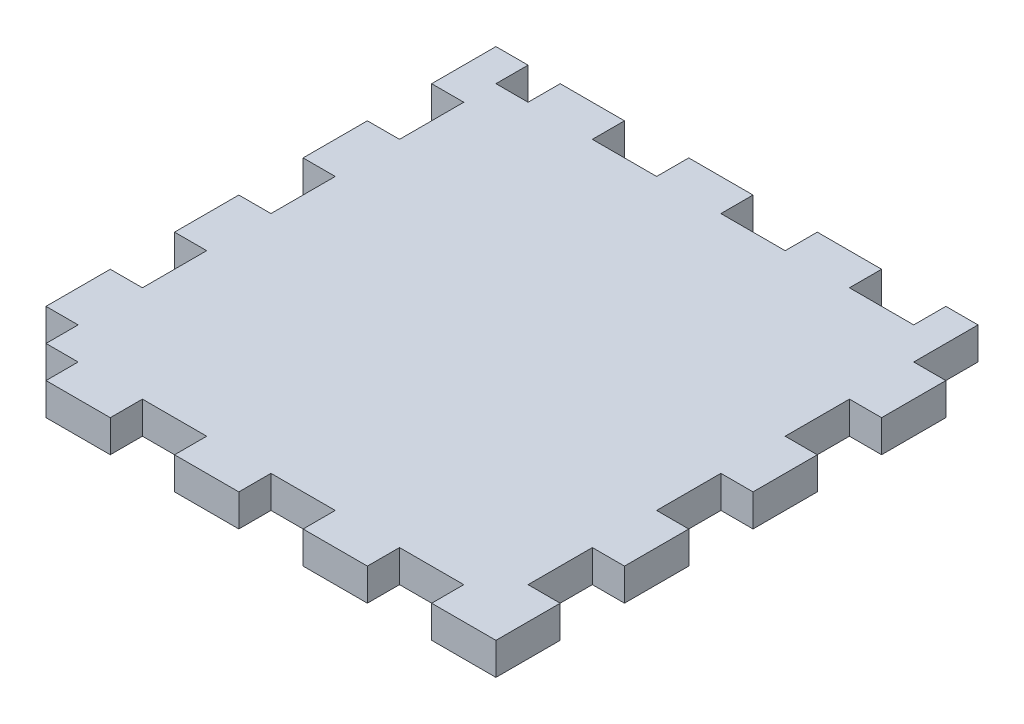
from build123d import *

# Parameters (mm, degrees)
SKETCH1_W           = 101.6
SKETCH1_H           = 101.6
BOSS_EXTRUDE1_DEPTH = 6.35
SKETCH2_W           = 6.35
SKETCH2_H           = 12.7
SKETCH2_H_2         = 6.35
CUT_EXTRUDE1_DEPTH  = 144.824345992
SKETCH2_3_W         = 6.35
SKETCH2_3_H         = 6.35
SKETCH2_3_W_2       = 12.7
CUT_EXTRUDE2_DEPTH  = 6.35


with BuildPart() as part:
    # Sketch1 → Boss-Extrude1 (new body)
    with BuildSketch(Plane(origin=(0, 0, 0), x_dir=(1, 0, 0), z_dir=(0, 1, 0))):
        with Locations((50.8, 50.8)):
            Rectangle(SKETCH1_W, SKETCH1_H)
    extrude(amount=BOSS_EXTRUDE1_DEPTH)

    # Sketch2 → Cut-Extrude1 (cut, through all)
    with BuildSketch(Plane(origin=(0, 6.35, 0), x_dir=(1, 0, 0), z_dir=(0, 1, 0))):
        with Locations((3.175, 82.55)):
            Rectangle(SKETCH2_W, SKETCH2_H)
        with Locations((3.175, 57.15)):
            Rectangle(SKETCH2_W, SKETCH2_H)
        with Locations((3.175, 31.75)):
            Rectangle(SKETCH2_W, SKETCH2_H)
        with Locations((3.175, 9.525)):
            Rectangle(SKETCH2_W, SKETCH2_H_2)
        with Locations((98.425, 95.25)):
            Rectangle(SKETCH2_W, SKETCH2_H)
        with Locations((98.425, 69.85)):
            Rectangle(SKETCH2_W, SKETCH2_H)
        with Locations((98.425, 44.45)):
            Rectangle(SKETCH2_W, SKETCH2_H)
        with Locations((98.425, 19.05)):
            Rectangle(SKETCH2_W, SKETCH2_H)
    extrude(amount=-CUT_EXTRUDE1_DEPTH, mode=Mode.SUBTRACT)

    # Sketch2<3> → Cut-Extrude2 (cut)
    with BuildSketch(Plane(origin=(0, 6.35, 0), x_dir=(1, 0, 0), z_dir=(0, 1, 0))):
        with Locations((9.525, 98.425)):
            Rectangle(SKETCH2_3_W, SKETCH2_3_H)
        with Locations((31.75, 98.425)):
            Rectangle(SKETCH2_3_W_2, SKETCH2_3_H)
        with Locations((57.15, 98.425)):
            Rectangle(SKETCH2_3_W_2, SKETCH2_3_H)
        with Locations((6.35, 3.175)):
            Rectangle(SKETCH2_3_W_2, SKETCH2_3_H)
        with Locations((82.55, 98.425)):
            Rectangle(SKETCH2_3_W_2, SKETCH2_3_H)
        with Locations((31.75, 3.175)):
            Rectangle(SKETCH2_3_W_2, SKETCH2_3_H)
        with Locations((57.15, 3.175)):
            Rectangle(SKETCH2_3_W_2, SKETCH2_3_H)
        with Locations((82.55, 3.175)):
            Rectangle(SKETCH2_3_W_2, SKETCH2_3_H)
    extrude(amount=-CUT_EXTRUDE2_DEPTH, mode=Mode.SUBTRACT)


solid = part.part
